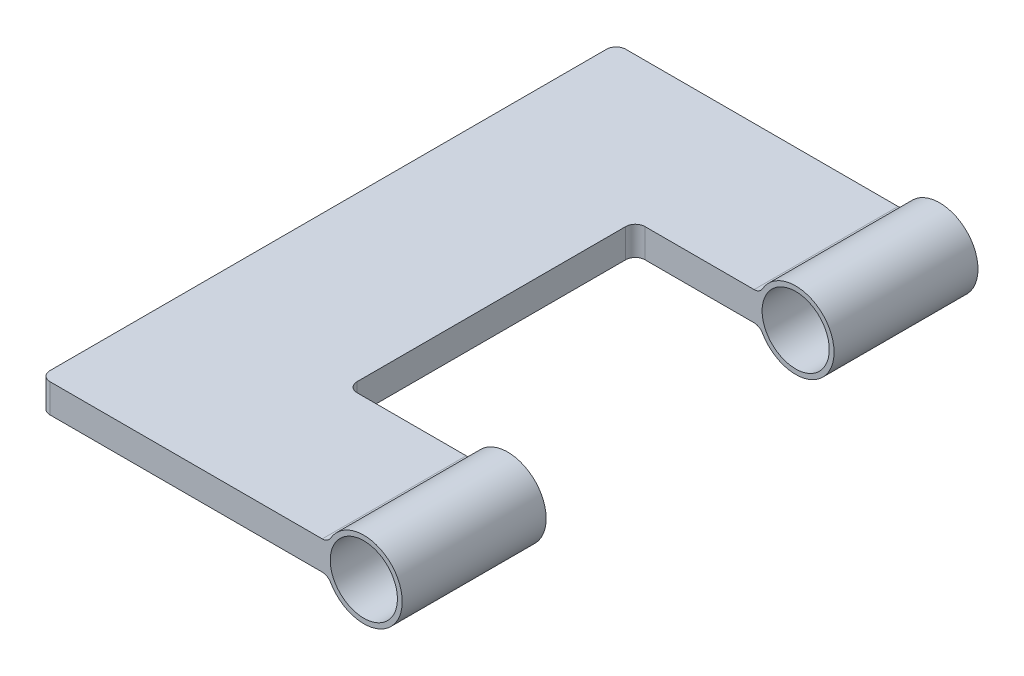
from build123d import *

# Parameters (mm, degrees)
BOSS_EXTRUDE2_DEPTH = 150
SKETCH4_W           = 110
SKETCH4_H           = 150
CUT_EXTRUDE1_DEPTH  = 150
FILLET1_R           = 5
SKETCH5_R           = 17.5
CUT_EXTRUDE2_DEPTH  = 378


with BuildPart() as part:
    # Sketch3 → Boss-Extrude2 (new, symmetric)
    with BuildSketch(Plane.XY):
        with BuildLine():
            Line((0, 0), (150, 0))
            ThreePointArc((150, 0), (188.540496218, 7.5), (150, 15))
            Line((150, 15), (0, 15))
            Line((0, 15), (0, 0))
        make_face()
    extrude(amount=BOSS_EXTRUDE2_DEPTH, both=True)

    # Sketch4 → Cut-Extrude1 (cut, symmetric)
    with BuildSketch(Plane(origin=(0, 0, 0), x_dir=(1, 0, 0), z_dir=(0, 1, 0))):
        with Locations((140, 0)):
            Rectangle(SKETCH4_W, SKETCH4_H)
    extrude(amount=CUT_EXTRUDE1_DEPTH, both=True, mode=Mode.SUBTRACT)

    # Fillet1
    fillet1_edges = [part.edges().sort_by_distance(p)[0] for p in [
        (150, 15, -112.5),
        (150, 0, -112.5),
        (85, 7.5, 75),
        (85, 7.5, -75),
        (0, 7.5, 150),
        (0, 7.5, -150),
        (150, 15, 112.5),
        (150, 0, 112.5),
    ]]
    fillet(fillet1_edges, radius=FILLET1_R)

    # Sketch5 → Cut-Extrude2 (cut, symmetric)
    with BuildSketch(Plane.XY.offset(150)):
        with Locations((168.540496218, 7.5)):
            Circle(SKETCH5_R)
    extrude(amount=CUT_EXTRUDE2_DEPTH, both=True, mode=Mode.SUBTRACT)


solid = part.part
